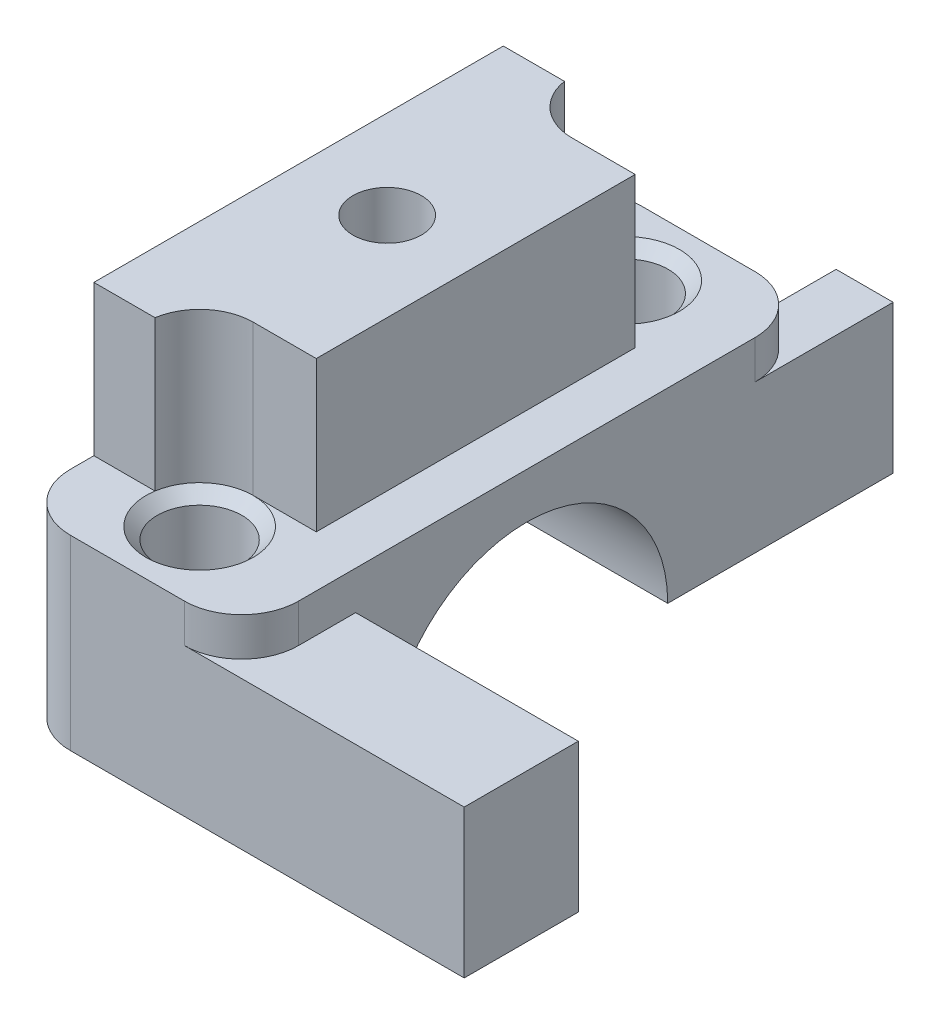
from build123d import *

# Parameters (mm, degrees)
BOSS_EXTRUDE1_DEPTH     = 20
FILLET1_R               = 5
CUT_EXTRUDE1_DEPTH      = 72.877952398
CUT_EXTRUDE1_DEPTH_BACK = 72.877952398
SKETCH2_R               = 2.2
SKETCH3_R               = 3.7
CUT_EXTRUDE2_DEPTH      = 8.846664929
CHAMFER2_SIZE           = 1
BOSS_EXTRUDE2_START     = -3.375
BOSS_EXTRUDE2_DEPTH     = 12.971664929
BOSS_EXTRUDE3_DEPTH     = 13.153335071
SKETCH6_R               = 3
CUT_EXTRUDE3_DEPTH      = 6.2
CUT_EXTRUDE4_DEPTH      = 74.770702766
CUT_EXTRUDE4_DEPTH_BACK = 74.770702766
SKETCH7_R               = 2.2


with BuildPart() as part:
    # Sketch1 → Boss-Extrude1 (new body)
    with BuildSketch(Plane(origin=(-19.912110777, 0, 0), x_dir=(0, 0, -1), z_dir=(1, 0, 0))):
        with BuildLine():
            Line((-52.5, 12.196664929), (-44.846664929, 12.196664929))
            ThreePointArc((-44.846664929, 12.196664929), (-32.5, 24.543329858), (-20.153335071, 12.196664929))
            Line((-20.153335071, 12.196664929), (-7.5, 12.196664929))
            Line((-7.5, 12.196664929), (-7.5, 28.543329858))
            Line((-7.5, 28.543329858), (-57.5, 28.543329858))
            Line((-57.5, 28.543329858), (-57.5, 12.196664929))
            Line((-57.5, 12.196664929), (-52.5, 12.196664929))
        make_face()
    extrude(amount=-BOSS_EXTRUDE1_DEPTH)

    # Fillet1
    fillet1_edges = [part.edges().sort_by_distance(p)[0] for p in [
        (-39.912110777, 20.369997393, 7.5),
        (-39.912110777, 20.369997393, 57.5),
        (-19.912110777, 20.369997393, 57.5),
        (-19.912110777, 20.369997393, 7.5),
    ]]
    fillet(fillet1_edges, radius=FILLET1_R)

    # Sketch2 → Cut-Extrude1 (cut, two sides: drawn at the far end of the back side and taken through both)
    with BuildSketch(Plane(origin=(0, 28.543329858, 0), x_dir=(1, 0, 0), z_dir=(0, 1, 0)).offset(-CUT_EXTRUDE1_DEPTH_BACK)):
        with Locations(Location((-29.912110777, -51.172876859, 0), (0, 0, 270))):
            Circle(SKETCH2_R)
        with Locations(Location((-29.912110777, -13.827123141, 0), (0, 0, 270))):
            Circle(SKETCH2_R)
    extrude(amount=CUT_EXTRUDE1_DEPTH + CUT_EXTRUDE1_DEPTH_BACK, mode=Mode.SUBTRACT)

    # Sketch3 → Cut-Extrude2 (cut)
    with BuildSketch(Plane(origin=(0, 28.543329858, 0), x_dir=(1, 0, 0), z_dir=(0, 1, 0))):
        with Locations(Location((-29.912110777, -51.172876859, 0), (0, 0, 270))):
            Circle(SKETCH3_R)
        with Locations(Location((-29.912110777, -13.827123141, 0), (0, 0, 270))):
            Circle(SKETCH3_R)
    extrude(amount=-CUT_EXTRUDE2_DEPTH, mode=Mode.SUBTRACT)

    # Chamfer2
    chamfer2_edges = [part.edges().sort_by_distance(p)[0] for p in [
        (-29.912110777, 28.543329858, 47.472876859),
        (-29.912110777, 28.543329858, 10.127123141),
    ]]
    chamfer(chamfer2_edges, length=CHAMFER2_SIZE)

    # Sketch4 → Boss-Extrude2 (add)
    with BuildSketch(Plane(origin=(0, 28.543329858, 0), x_dir=(1, 0, 0), z_dir=(0, 1, 0)).offset(BOSS_EXTRUDE2_START)):
        with BuildLine():
            Line((-0.4, -47.5), (-19.912110777, -47.5))
            Line((-19.912110777, -47.5), (-19.912110777, -52.5))
            ThreePointArc((-19.912110777, -52.5), (-21.376576871, -56.035533906), (-24.912110777, -57.5))
            Line((-24.912110777, -57.5), (-0.4, -57.5))
            Line((-0.4, -57.5), (-0.4, -47.5))
        make_face()
        with BuildLine():
            Line((-19.912110777, -0.4), (-24.912110777, -0.4))
            Line((-24.912110777, -0.4), (-24.912110777, -7.5))
            ThreePointArc((-24.912110777, -7.5), (-21.376576871, -8.964466094), (-19.912110777, -12.5))
            Line((-19.912110777, -12.5), (-19.912110777, -0.4))
        make_face()
    extrude(amount=-BOSS_EXTRUDE2_DEPTH)

    # Sketch5 → Boss-Extrude3 (add)
    with BuildSketch(Plane(origin=(0, 28.543329858, 0), x_dir=(1, 0, 0), z_dir=(0, 1, 0))):
        with BuildLine():
            Line((-29.912110777, -46.472876859), (-24.38878903, -46.472876859))
            Line((-24.38878903, -46.472876859), (-24.38878903, -18.527123141))
            Line((-24.38878903, -18.527123141), (-29.912110777, -18.527123141))
            ThreePointArc((-29.912110777, -18.527123141), (-32.964467867, -17.401072804), (-34.554225923, -14.562491734))
            Line((-34.554225923, -14.562491734), (-39.912110777, -14.562491734))
            Line((-39.912110777, -14.562491734), (-39.912110777, -50.437508266))
            Line((-39.912110777, -50.437508266), (-34.554225923, -50.437508266))
            ThreePointArc((-34.554225923, -50.437508266), (-32.964467867, -47.598927196), (-29.912110777, -46.472876859))
        make_face()
    extrude(amount=BOSS_EXTRUDE3_DEPTH)

    # Sketch6 → Cut-Extrude3 (cut)
    with BuildSketch(Plane(origin=(0, 41.696664929, 0), x_dir=(1, 0, 0), z_dir=(0, 1, 0))):
        with Locations(Location((-32.150449903, -32.5, 0), (0, 0, 270))):
            Circle(SKETCH6_R)
    extrude(amount=-CUT_EXTRUDE3_DEPTH, mode=Mode.SUBTRACT)

    # Sketch7 → Cut-Extrude4 (cut, two sides: drawn at the far end of the back side and taken through both)
    with BuildSketch(Plane(origin=(0, 35.496664929, 0), x_dir=(1, 0, 0), z_dir=(0, 1, 0)).offset(-CUT_EXTRUDE4_DEPTH_BACK)):
        with Locations(Location((-32.150449903, -32.5, 0), (0, 0, 270))):
            Circle(SKETCH7_R)
    extrude(amount=CUT_EXTRUDE4_DEPTH + CUT_EXTRUDE4_DEPTH_BACK, mode=Mode.SUBTRACT)


solid = part.part
